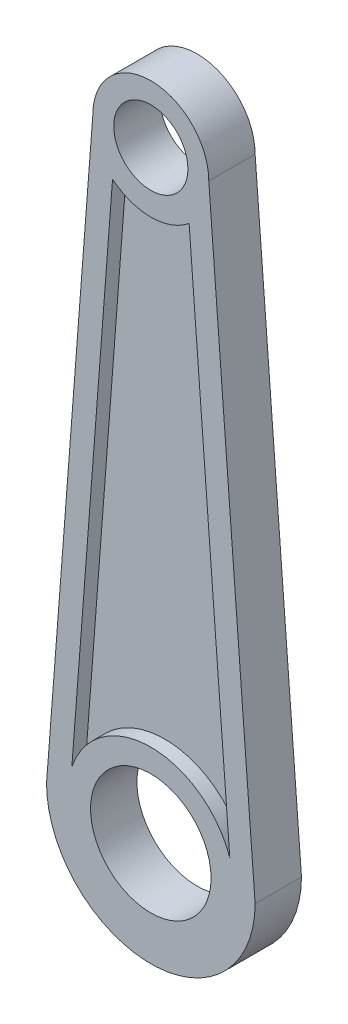
from build123d import *

# Parameters (mm, degrees)
SKETCH2_R           = 12.5
SKETCH2_R_2         = 8
SKETCH2_R_3         = 13
BOSS_EXTRUDE1_DEPTH = 5
CUT_EXTRUDE1_DEPTH  = 3


with BuildPart() as part:
    # Sketch2 → Boss-Extrude1 (new, symmetric)
    # profile 1 of 3: a face of its own
    with BuildSketch(Plane.XY):
        with Locations((0, 130)):
            Circle(SKETCH2_R)
        with Locations((0, 130)):
            Circle(SKETCH2_R_2, mode=Mode.SUBTRACT)
    # profile 2 of 3: a face of its own
    with BuildSketch(Plane.XY):
        with BuildLine():
            Line((-12.5, 130), (-22.235294118, 3.441176471))
            ThreePointArc((-22.235294118, 3.441176471), (0, 22.5), (22.235294118, 3.441176471))
            Line((22.235294118, 3.441176471), (12.5, 130))
            ThreePointArc((12.5, 130), (0, 117.5), (-12.5, 130))
        make_face()
    # profile 3 of 3: a face of its own
    with BuildSketch(Plane.XY):
        with BuildLine():
            Line((-22.235294118, 3.441176471), (-22.5, 0))
            ThreePointArc((-22.5, 0), (0, -22.5), (22.5, 0))
            Line((22.5, 0), (22.235294118, 3.441176471))
            ThreePointArc((22.235294118, 3.441176471), (0, 22.5), (-22.235294118, 3.441176471))
        make_face()
        Circle(SKETCH2_R_3, mode=Mode.SUBTRACT)
    extrude(amount=BOSS_EXTRUDE1_DEPTH, both=True)

    # Sketch3 → Cut-Extrude1 (cut)
    with BuildSketch(Plane.XY.offset(5)):
        with BuildLine():
            Line((-8.257578004, 119.959461892), (-17.038818827, 5.803331197))
            ThreePointArc((-17.038818827, 5.803331197), (0, 18), (17.038818827, 5.803331197))
            Line((17.038818827, 5.803331197), (8.257578004, 119.959461892))
            ThreePointArc((8.257578004, 119.959461892), (0, 117), (-8.257578004, 119.959461892))
        make_face()
    cut_extrude1 = extrude(amount=-CUT_EXTRUDE1_DEPTH, mode=Mode.SUBTRACT)

    # Mirror1: Cut-Extrude1 across plane
    add(cut_extrude1.mirror(Plane.XY), mode=Mode.SUBTRACT)


solid = part.part
